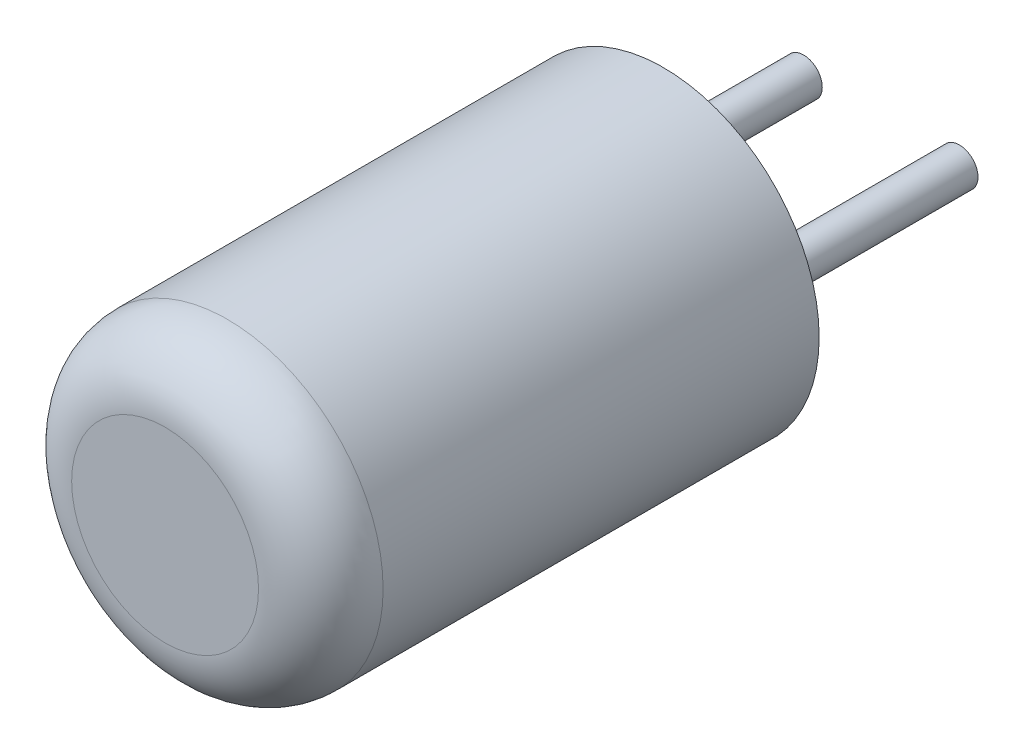
from build123d import *

# Parameters (mm, degrees)
SKETCH_1_R      = 2.5
EXTRUDE_1_DEPTH = 8
SKETCH_2_R      = 0.3
EXTRUDE_2_DEPTH = 3.5
FILLET_1_R      = 1


with BuildPart() as part:
    # Эскиз1 → Вытянуть1 (new body)
    with BuildSketch(Plane.XY):
        Circle(SKETCH_1_R)
    extrude(amount=EXTRUDE_1_DEPTH)

    # Эскиз2 → Вытянуть2 (add)
    with BuildSketch(Plane(origin=(0, 0, 0), x_dir=(-1, 0, 0), z_dir=(0, 0, -1))):
        with Locations(Location((-1.25, 0, 0), (0, 0, 180))):
            Circle(SKETCH_2_R)
        with Locations(Location((1.25, 0, 0), (0, 0, 180))):
            Circle(SKETCH_2_R)
    extrude(amount=EXTRUDE_2_DEPTH)

    # Скругление1
    fillet_1_edges = [part.edges().sort_by_distance(p)[0] for p in [
        (-2.5, 0, 8),
    ]]
    fillet(fillet_1_edges, radius=FILLET_1_R)


solid = part.part
